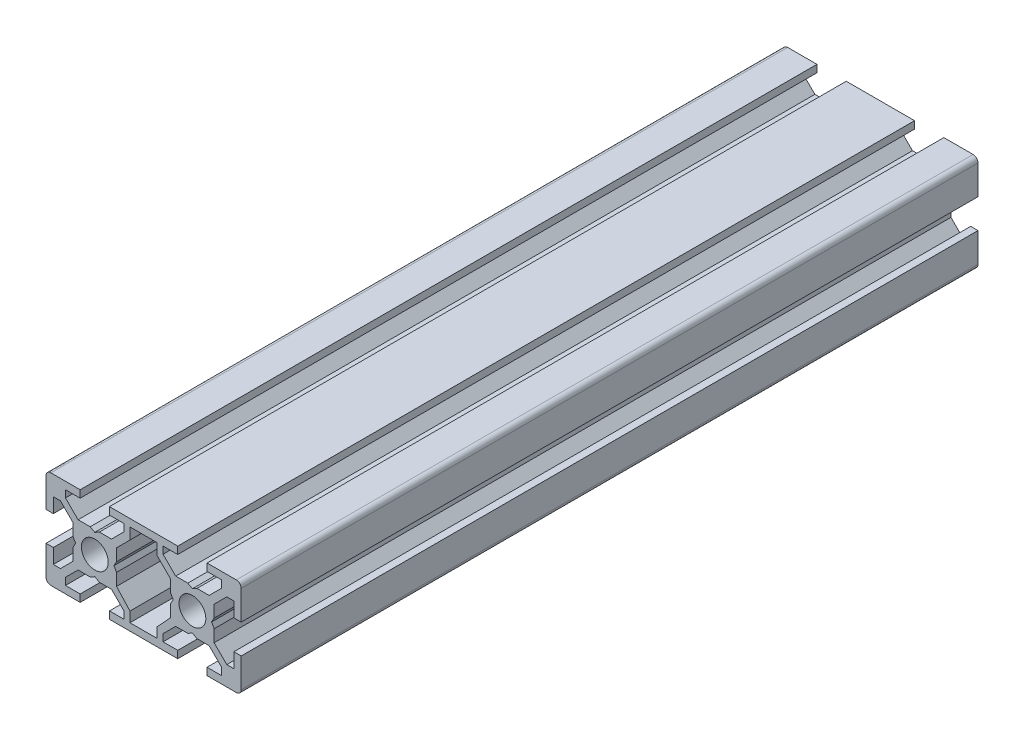
from build123d import *

# Parameters (mm, degrees)
SKETCH1_R           = 2.75
BOSS_EXTRUDE1_DEPTH = 151
FILLET2_R           = 1
FILLET4_R           = 1
FILLET5_R           = 1
FILLET6_R           = 1


with BuildPart() as part:
    # Sketch1 → Boss-Extrude1 (new body)
    with BuildSketch(Plane.XY):
        Polygon((-3.001792446, 10), (-10, 10), (-10, 3.001792446), (-8.500771543, 3.001792446), (-8.500771543, 6.014407427), (-7.045753692, 6.014407427), (-4.458187435, 3.426841169), (-4.458187435, 0.939646666), (-3.934715846, 0), (-4.45749106, -0.939646666), (-4.458187435, -3.426841169), (-7.045753692, -6.014407427), (-8.500771543, -6.014407427), (-8.500771543, -3.001792446), (-10, -3.001792446), (-10, -10), (-3.001792446, -10), (-3.001792446, -8.499999951), (-6.014791508, -8.499999951), (-6.014791508, -7.045753643), (-3.427225251, -4.458187385), (-0.939604714, -4.458187385), (-0.00108721, -3.933944043), (0.937618184, -4.457850876), (3.425238721, -4.457850876), (6.012804978, -7.045417133), (6.012804978, -8.500000007), (3.001792545, -8.500000007), (3.001792545, -10), (16.998207455, -10), (16.998207455, -8.500000007), (13.987195022, -8.500000007), (13.987195022, -7.045417133), (16.574761279, -4.457850876), (19.062381816, -4.457850876), (20.00108721, -3.933944043), (20.939604714, -4.458187385), (23.427225251, -4.458187385), (26.014791508, -7.045753643), (26.014791508, -8.499999951), (23.001792446, -8.499999951), (23.001792446, -10), (30, -10), (30, -3.001792446), (28.500771543, -3.001792446), (28.500771543, -6.014407427), (27.045753692, -6.014407427), (24.458187435, -3.426841169), (24.45749106, -0.939646666), (23.934715846, 0), (24.458187435, 0.939646666), (24.458187435, 3.426841169), (27.045753692, 6.014407427), (28.500771543, 6.014407427), (28.500771543, 3.001792446), (30, 3.001792446), (30, 10), (23.001792446, 10), (23.001792446, 8.499999951), (26.014791508, 8.499999951), (26.014791508, 7.045753643), (23.427225251, 4.458187385), (20.939604714, 4.458187385), (20.00108721, 3.933944043), (19.062381816, 4.457850876), (16.574761279, 4.457850876), (13.987195022, 7.045417133), (13.987195022, 8.499999951), (16.998207356, 8.499999951), (16.998207356, 10), (3.001792643, 10), (3.001792643, 8.499999951), (6.012804978, 8.499999951), (6.012804978, 7.045417133), (3.425238721, 4.457850876), (0.937618184, 4.457850876), (-0.00108721, 3.933944043), (-0.939604714, 4.458187385), (-3.427225251, 4.458187385), (-6.014791508, 7.045753643), (-6.014791508, 8.499999951), (-3.001792446, 8.499999951), align=None)
        Circle(SKETCH1_R, mode=Mode.SUBTRACT)
        with Locations(Location((20, 0, 0), (0, 0, 180))):
            Circle(SKETCH1_R, mode=Mode.SUBTRACT)
        Polygon((7.208733292, -6.419793455), (7.208733292, -8.500000007), (12.791266708, -8.500000007), (12.791266708, -6.419793455), (15.541654987, -3.426231961), (15.541209058, -0.938611464), (16.065284154, 0), (15.54250894, 0.939646666), (15.541655044, 3.426231961), (12.791266708, 6.17760654), (12.791266708, 8.499999951), (7.208733292, 8.499999951), (7.208733292, 6.17760654), (4.458344956, 3.426231961), (4.45749106, 0.939646666), (3.934715846, 0), (4.458790942, -0.938611464), (4.458345013, -3.426231961), align=None, mode=Mode.SUBTRACT)
    extrude(amount=BOSS_EXTRUDE1_DEPTH)

    # Fillet2
    fillet2_edges = [part.edges().sort_by_distance(p)[0] for p in [
        (-10, -10, 75.5),
    ]]
    fillet(fillet2_edges, radius=FILLET2_R)

    # Fillet4
    fillet4_edges = [part.edges().sort_by_distance(p)[0] for p in [
        (-10, 10, 75.5),
    ]]
    fillet(fillet4_edges, radius=FILLET4_R)

    # Fillet5
    fillet5_edges = [part.edges().sort_by_distance(p)[0] for p in [
        (30, 10, 75.5),
    ]]
    fillet(fillet5_edges, radius=FILLET5_R)

    # Fillet6
    fillet6_edges = [part.edges().sort_by_distance(p)[0] for p in [
        (30, -10, 75.5),
    ]]
    fillet(fillet6_edges, radius=FILLET6_R)


solid = part.part
